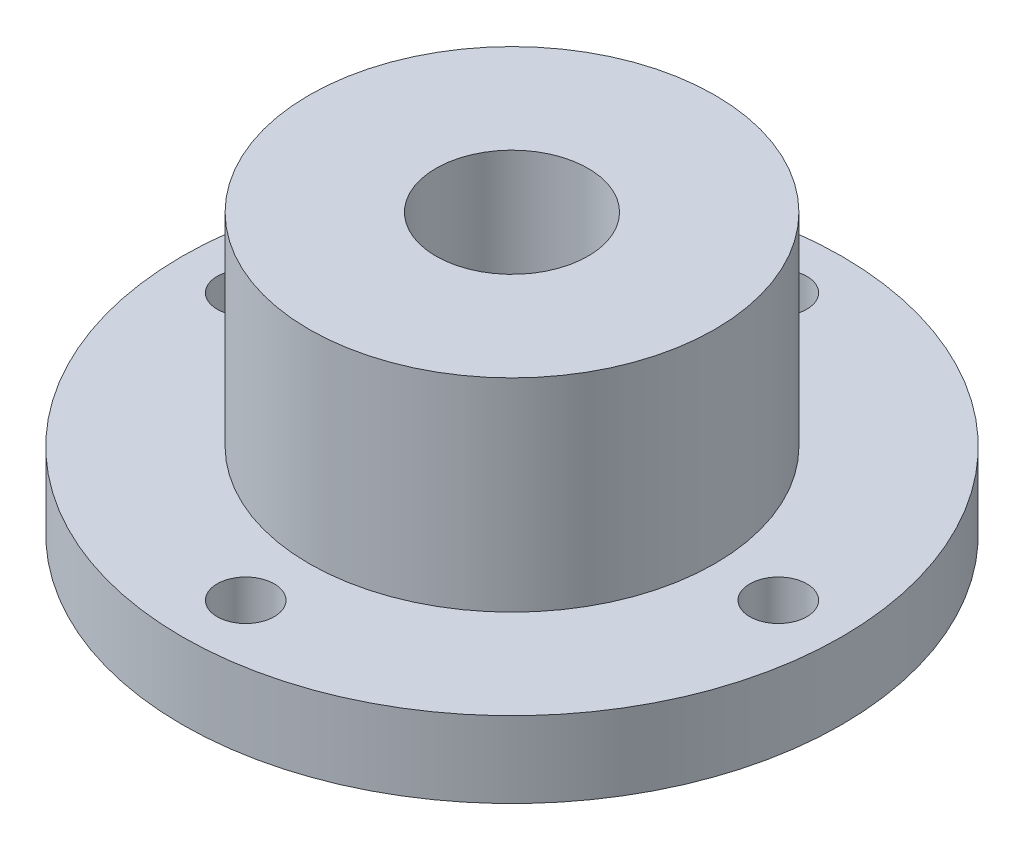
from build123d import *

# Parameters (mm, degrees)
SKETCH_1_R      = 26
SKETCH_1_R_2    = 2.25
SKETCH_1_R_3    = 16
EXTRUDE_1_DEPTH = 6
SKETCH_1_6_R    = 16
SKETCH_1_6_R_2  = 6
EXTRUDE_2_DEPTH = 22


with BuildPart() as part:
    # 草图1 → 凸台-拉伸1 (new body)
    with BuildSketch(Plane(origin=(0, 0, 0), x_dir=(1, 0, 0), z_dir=(0, 1, 0))):
        Circle(SKETCH_1_R)
        with Locations((0, -21)):
            Circle(SKETCH_1_R_2, mode=Mode.SUBTRACT)
        with Locations((-21, 0)):
            Circle(SKETCH_1_R_2, mode=Mode.SUBTRACT)
        Circle(SKETCH_1_R_3, mode=Mode.SUBTRACT)
        with Locations((21, 0)):
            Circle(SKETCH_1_R_2, mode=Mode.SUBTRACT)
        with Locations((0, 21)):
            Circle(SKETCH_1_R_2, mode=Mode.SUBTRACT)
    extrude(amount=EXTRUDE_1_DEPTH)

    # 草图1<6> → 凸台-拉伸2 (add)
    with BuildSketch(Plane(origin=(0, 0, 0), x_dir=(1, 0, 0), z_dir=(0, 1, 0))):
        Circle(SKETCH_1_6_R)
        Circle(SKETCH_1_6_R_2, mode=Mode.SUBTRACT)
    extrude(amount=EXTRUDE_2_DEPTH)


solid = part.part
